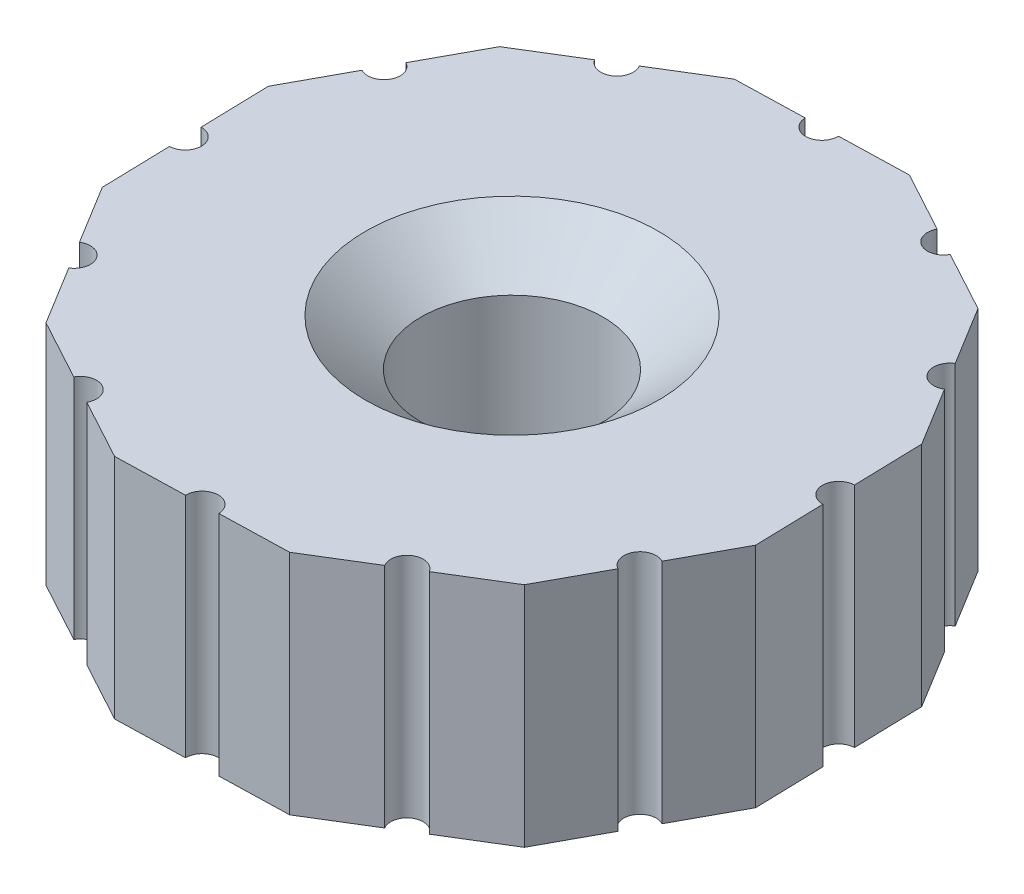
from build123d import *

# Parameters (mm, degrees)
SKETCH1_R                                           = 4
BOSS_EXTRUDE1_DEPTH                                 = 10
CSK_FOR_1_4_FLAT_HEAD_MACHINE_SCREW_100_D           = 7.14248
CSK_FOR_1_4_FLAT_HEAD_MACHINE_SCREW_100_CSINK_D     = 12.8778
CSK_FOR_1_4_FLAT_HEAD_MACHINE_SCREW_100_CSINK_ANGLE = 100


with BuildPart() as part:
    # Sketch1 → Boss-Extrude1 (new body)
    with BuildSketch(Plane(origin=(0, 0, 0), x_dir=(1, 0, 0), z_dir=(0, 1, 0))):
        with BuildLine():
            Line((-62.460834708, 11.244058758), (-63.909867943, 8.573388842))
            Line((-63.909867943, 8.573388842), (-63.829432577, 5.536004231))
            ThreePointArc((-63.829432577, 5.536004231), (-63.097972523, 4.842285457), (-63.791691298, 4.110825404))
            Line((-63.791691298, 4.110825404), (-63.711255932, 1.073440793))
            Line((-63.711255932, 1.073440793), (-62.122904556, -1.516793758))
            ThreePointArc((-62.122904556, -1.516793758), (-61.142582181, -1.751841812), (-61.377630236, -2.732164188))
            Line((-61.377630236, -2.732164188), (-59.78927886, -5.322398739))
            Line((-59.78927886, -5.322398739), (-57.118608944, -6.771431974))
            ThreePointArc((-57.118608944, -6.771431974), (-56.152100835, -6.484828372), (-55.865497234, -7.451336481))
            Line((-55.865497234, -7.451336481), (-53.194827318, -8.900369716))
            Line((-53.194827318, -8.900369716), (-50.157442707, -8.81993435))
            ThreePointArc((-50.157442707, -8.81993435), (-49.463723933, -8.088474296), (-48.732263879, -8.782193071))
            Line((-48.732263879, -8.782193071), (-45.694879269, -8.701757705))
            Line((-45.694879269, -8.701757705), (-43.104644718, -7.11340633))
            ThreePointArc((-43.104644718, -7.11340633), (-42.869596663, -6.133083954), (-41.889274288, -6.368132009))
            Line((-41.889274288, -6.368132009), (-39.299039737, -4.779780634))
            Line((-39.299039737, -4.779780634), (-37.850006502, -2.109110717))
            ThreePointArc((-37.850006502, -2.109110717), (-38.136610103, -1.142602609), (-37.170101995, -0.855999007))
            Line((-37.170101995, -0.855999007), (-35.72106876, 1.814670909))
            Line((-35.72106876, 1.814670909), (-35.801504126, 4.852055519))
            ThreePointArc((-35.801504126, 4.852055519), (-36.532964179, 5.545774294), (-35.839245405, 6.277234347))
            Line((-35.839245405, 6.277234347), (-35.919680771, 9.314618958))
            Line((-35.919680771, 9.314618958), (-37.508032146, 11.904853509))
            ThreePointArc((-37.508032146, 11.904853509), (-38.488354522, 12.139901563), (-38.253306467, 13.120223939))
            Line((-38.253306467, 13.120223939), (-39.841657842, 15.71045849))
            Line((-39.841657842, 15.71045849), (-42.512327759, 17.159491725))
            ThreePointArc((-42.512327759, 17.159491725), (-43.478835867, 16.872888123), (-43.765439468, 17.839396232))
            Line((-43.765439468, 17.839396232), (-46.436109385, 19.288429467))
            Line((-46.436109385, 19.288429467), (-49.473493995, 19.207994101))
            ThreePointArc((-49.473493995, 19.207994101), (-50.16721277, 18.476534047), (-50.898672823, 19.170252822))
            Line((-50.898672823, 19.170252822), (-53.936057434, 19.089817456))
            Line((-53.936057434, 19.089817456), (-56.526291984, 17.501466081))
            ThreePointArc((-56.526291984, 17.501466081), (-56.761340039, 16.521143705), (-57.741662415, 16.75619176))
            Line((-57.741662415, 16.75619176), (-60.331896965, 15.167840385))
            Line((-60.331896965, 15.167840385), (-61.7809302, 12.497170468))
            ThreePointArc((-61.7809302, 12.497170468), (-61.494326599, 11.530662359), (-62.460834708, 11.244058758))
        make_face()
        with Locations(Location((-49.815468351, 5.194029875, 0), (0, 0, 270))):
            Circle(SKETCH1_R, mode=Mode.SUBTRACT)
    extrude(amount=BOSS_EXTRUDE1_DEPTH)

    # CSK for 1/4 Flat Head Machine Screw (100)1 (through all)
    with Locations(Plane(origin=(-49.815468351, 10, -5.194029875), x_dir=(0, 0, 1), z_dir=(0, 1, 0))):
        with Locations((0, 0)):
            CounterSinkHole(CSK_FOR_1_4_FLAT_HEAD_MACHINE_SCREW_100_D / 2, CSK_FOR_1_4_FLAT_HEAD_MACHINE_SCREW_100_CSINK_D / 2, counter_sink_angle=CSK_FOR_1_4_FLAT_HEAD_MACHINE_SCREW_100_CSINK_ANGLE)


solid = part.part
